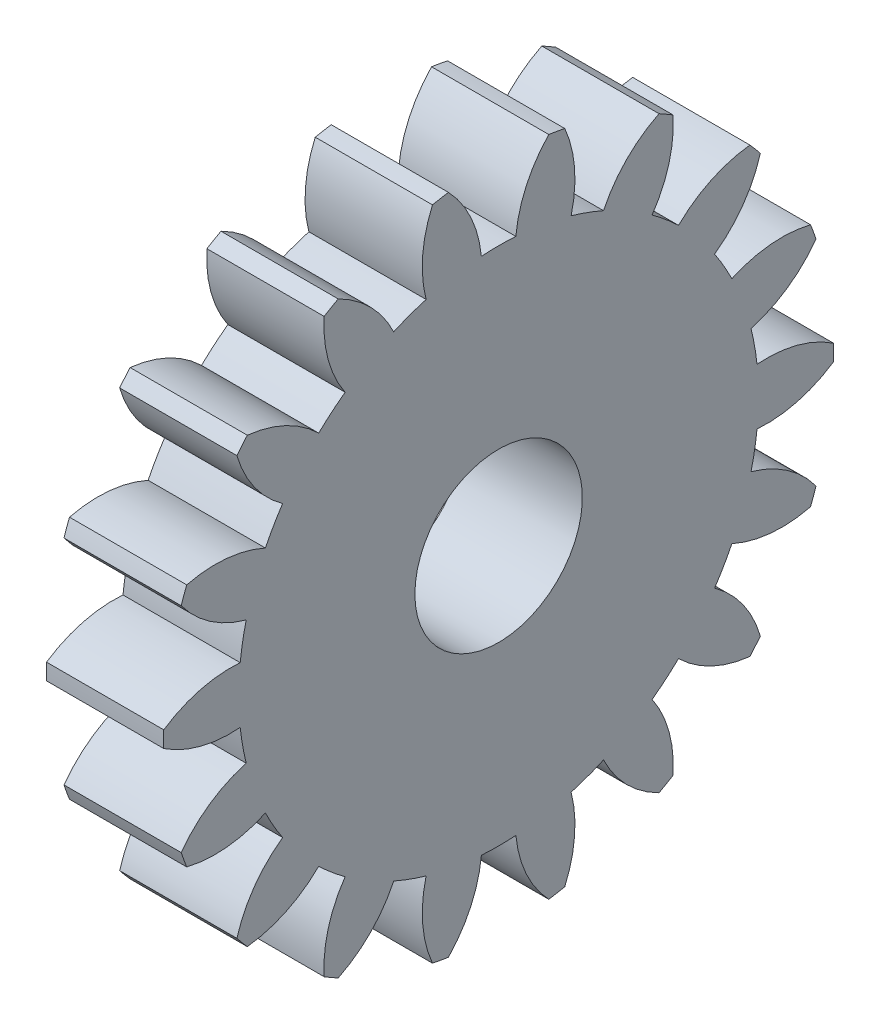
from build123d import *

# Parameters (mm, degrees)
BASPROSKE_W     = 4.445
BASPROSKE_H     = 12.7
TOOTHCUT_DEPTH  = 19.502378901
TEETHCUTS_COUNT = 18
TEETHCUTS_ANGLE = 340
BORSKE_R        = 3.175
BORE_DEPTH      = 50.8000508


with BuildPart() as part:
    # BasProSke → Base-Revolve (revolve)
    with BuildSketch(Plane(origin=(0, 0, 0), x_dir=(1, 0, 0), z_dir=(0, 1, 0)), mode=Mode.PRIVATE) as base_revolve_sk:
        with Locations((2.2225, 6.35)):
            Rectangle(BASPROSKE_W, BASPROSKE_H)
    revolve(base_revolve_sk.sketch.rotate(Axis((-10, 0, 0), (1, 0, 0)), 180), axis=Axis((-10, 0, 0), (1, 0, 0)))

    # TooCutSke → ToothCut (cut, through all)
    with BuildSketch(Plane(origin=(0, 0, 0), x_dir=(0, 0, -1), z_dir=(1, 0, 0))):
        with BuildLine():
            ThreePointArc((0.653663469, 9.833498417), (0, 9.8552), (-0.653663469, 9.833498417))
            ThreePointArc((-0.653663469, 9.833498417), (-1.05484238, 11.314407704), (-1.923354389, 12.579209556))
            ThreePointArc((-1.923354389, 12.579209556), (0, 12.7254), (1.923354389, 12.579209556))
            ThreePointArc((1.923354389, 12.579209556), (1.05484238, 11.314407704), (0.653663469, 9.833498417))
        make_face()
    toothcut = extrude(amount=TOOTHCUT_DEPTH, mode=Mode.SUBTRACT)

    # TeethCuts: ToothCut ×18 about axis
    teethcuts_axis = Axis((-10, 0, 0), (1, 0, 0))
    for i in range(1, TEETHCUTS_COUNT):
        add(toothcut.rotate(teethcuts_axis, i * TEETHCUTS_ANGLE / (TEETHCUTS_COUNT - 1)), mode=Mode.SUBTRACT)

    # BorSke → Bore (cut, symmetric)
    with BuildSketch(Plane(origin=(0, 0, 0), x_dir=(0, 0, -1), z_dir=(1, 0, 0))):
        with Locations(Location((0, 0, 0), (0, 0, 180))):
            Circle(BORSKE_R)
    extrude(amount=BORE_DEPTH, both=True, mode=Mode.SUBTRACT)


solid = part.part
